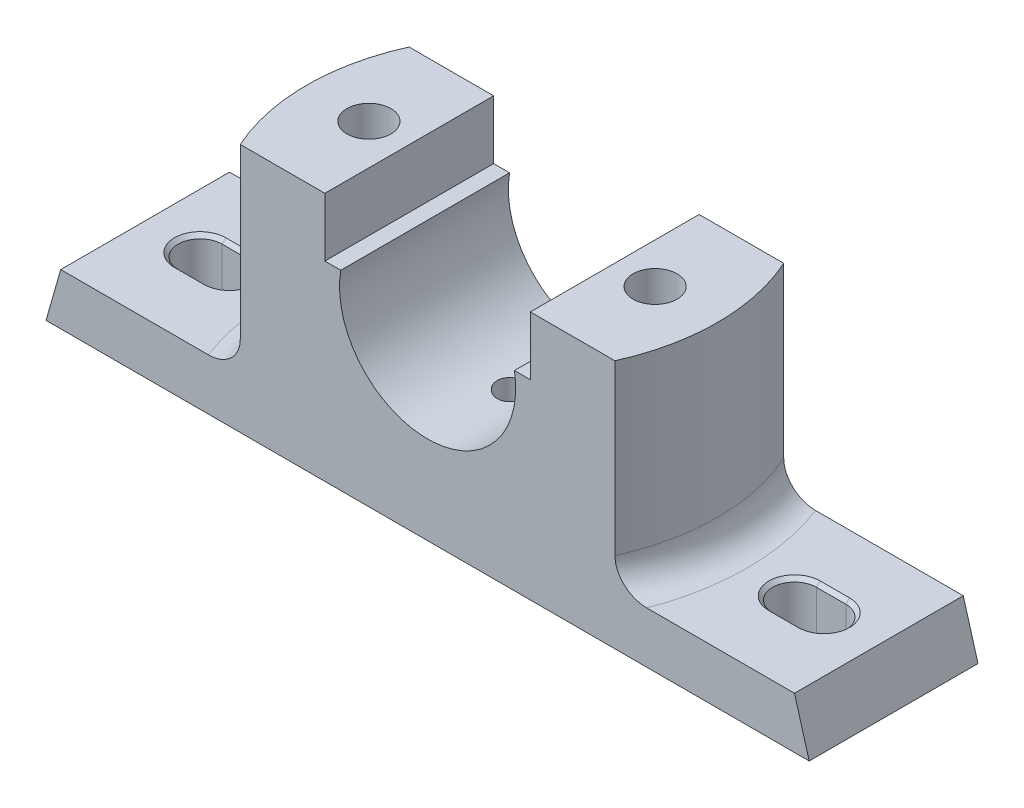
from build123d import *

# Parameters (mm, degrees)
BOSS_EXTRUDE2_DEPTH = 23
BOSS_EXTRUDE3_DEPTH = 54
CUT_EXTRUDE1_DEPTH  = 27
CUT_EXTRUDE3_DEPTH  = 127.368508735
SKETCH8_W           = 26
SKETCH8_H           = 26
CUT_EXTRUDE4_DEPTH  = 10
SKETCH9_R           = 6
CUT_EXTRUDE5_DEPTH  = 127.368508735
SKETCH10_R          = 4
CUT_EXTRUDE7_DEPTH  = 52
CHAMFER2_SIZE       = 1
FILLET1_R           = 8


with BuildPart() as part:
    # Sketch1 → Boss-Extrude2 (new, symmetric)
    with BuildSketch(Plane.XY):
        Polygon((-104, 0), (104, 0), (99.985564599, 14), (-99.985564599, 14), align=None)
    extrude(amount=BOSS_EXTRUDE2_DEPTH, both=True)

    # Sketch3 → Boss-Extrude3 (add)
    with BuildSketch(Plane(origin=(0, 14, 0), x_dir=(1, 0, 0), z_dir=(0, 1, 0))):
        with BuildLine():
            ThreePointArc((51.058789645, -23), (56, 0), (51.058789645, 23))
            Line((51.058789645, 23), (-51.058789645, 23))
            ThreePointArc((-51.058789645, 23), (-56, 0), (-51.058789645, -23))
            Line((-51.058789645, -23), (51.058789645, -23))
        make_face()
    extrude(amount=BOSS_EXTRUDE3_DEPTH)

    # Sketch5 → Cut-Extrude1 (cut, symmetric)
    with BuildSketch(Plane.XY):
        with BuildLine():
            Line((-28, 75.269278216), (-28, 52))
            Line((-28, 52), (-23.664319132, 52))
            ThreePointArc((-23.664319132, 52), (0, 24), (23.664319132, 52))
            Line((23.664319132, 52), (28, 52))
            Line((28, 52), (28, 75.269278216))
            Line((28, 75.269278216), (-28, 75.269278216))
        make_face()
    extrude(amount=CUT_EXTRUDE1_DEPTH, both=True, mode=Mode.SUBTRACT)

    # Sketch6 → Cut-Extrude3 (cut, through all)
    with BuildSketch(Plane(origin=(0, 68, 0), x_dir=(1, 0, 0), z_dir=(0, 1, 0))):
        with BuildLine():
            Line((-85, 6), (-77, 6))
            ThreePointArc((-77, 6), (-71, 0), (-77, -6))
            Line((-77, -6), (-85, -6))
            ThreePointArc((-85, -6), (-91, 0), (-85, 6))
        make_face()
        with BuildLine():
            Line((77, 6), (85, 6))
            ThreePointArc((85, 6), (91, 0), (85, -6))
            Line((85, -6), (77, -6))
            ThreePointArc((77, -6), (71, 0), (77, 6))
        make_face()
    extrude(amount=-CUT_EXTRUDE3_DEPTH, mode=Mode.SUBTRACT)

    # Sketch8 → Cut-Extrude4 (cut)
    with BuildSketch(Plane.XZ):
        with Locations((39, 0)):
            Rectangle(SKETCH8_W, SKETCH8_H)
        with Locations((-39, 0)):
            Rectangle(SKETCH8_W, SKETCH8_H)
    extrude(amount=-CUT_EXTRUDE4_DEPTH, mode=Mode.SUBTRACT)

    # Sketch9 → Cut-Extrude5 (cut, through all)
    with BuildSketch(Plane.XZ):
        with Locations(Location((-39, 0, 0), (0, 0, 270))):
            Circle(SKETCH9_R)
        with Locations(Location((39, 0, 0), (0, 0, 90))):
            Circle(SKETCH9_R)
    extrude(amount=-CUT_EXTRUDE5_DEPTH, mode=Mode.SUBTRACT)

    # Sketch10 → Cut-Extrude7 (cut)
    with BuildSketch(Plane(origin=(0, 14, 0), x_dir=(1, 0, 0), z_dir=(0, 1, 0))):
        with Locations(Location((0, 0, 0), (0, 0, 90))):
            Circle(SKETCH10_R)
    extrude(amount=CUT_EXTRUDE7_DEPTH, mode=Mode.SUBTRACT)

    # Chamfer2
    chamfer2_edges = [part.edges().sort_by_distance(p)[0] for p in [
        (81, 14, 6),
        (91, 14, 0),
        (81, 14, -6),
        (71, 14, 0),
        (-91, 14, 0),
        (-81, 14, -6),
        (-71, 14, 0),
        (-81, 14, 6),
    ]]
    chamfer(chamfer2_edges, length=CHAMFER2_SIZE)

    # Fillet1
    fillet1_edges = [part.edges().sort_by_distance(p)[0] for p in [
        (56, 14, 0),
        (-56, 14, 0),
    ]]
    fillet(fillet1_edges, radius=FILLET1_R)


solid = part.part
